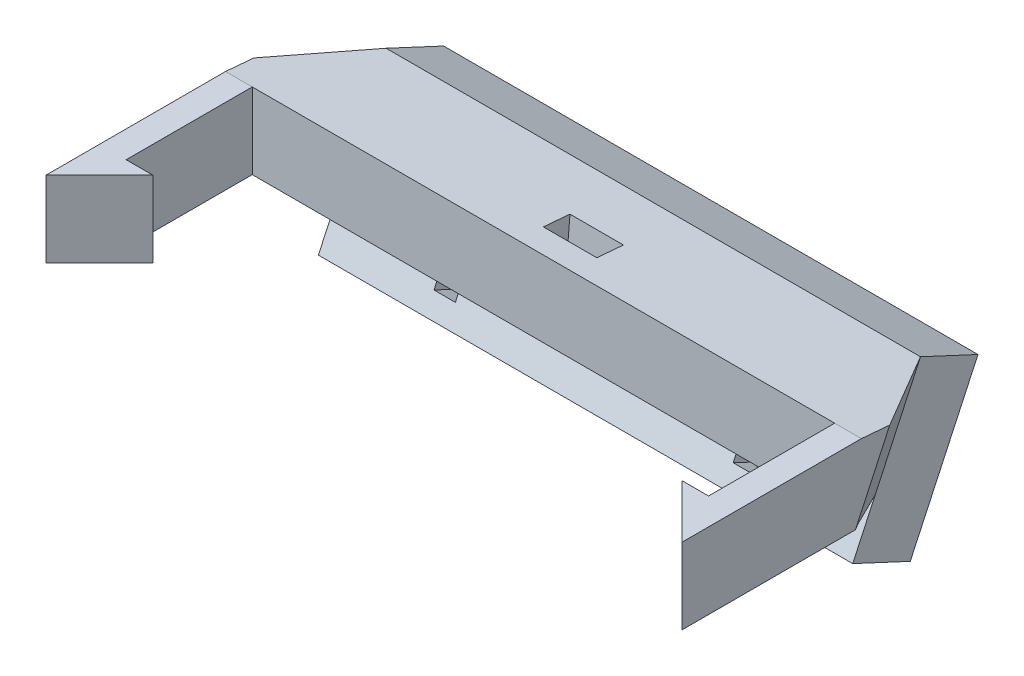
from build123d import *

# Parameters (mm, degrees)
SKETCH1_W                      = 75.565
SKETCH1_H                      = 35.56
BOSS_EXTRUDE1_DEPTH            = 3.175
SKETCH6_W                      = 3.175
SKETCH6_H                      = 9.028368652
BOSS_EXTRUDE4_DEPTH            = 14.986
BOSS_EXTRUDE6_DEPTH            = 9.028368652
BOSS_EXTRUDE7_DEPTH            = 75.565
SKETCH10_W                     = 75.565
SKETCH10_H                     = 23.368
BOSS_EXTRUDE8_DEPTH            = 7.545165067
CUT_EXTRUDE1_DEPTH             = 82.271037461
CUT_EXTRUDE2_REACH             = 52.467
SKETCH12_W                     = 6.35
SKETCH12_H                     = 3.175
CUT_EXTRUDE2_DIRECTION_2_DEPTH = 51.467280161
CUT_EXTRUDE3_DEPTH             = 54.64731815
CUT_EXTRUDE4_REACH             = 56.954
SKETCH14_W                     = 2.54
SKETCH14_H                     = 3.81
CUT_EXTRUDE5_REACH             = 56.954
SKETCH15_W                     = 114.661215645
SKETCH15_H                     = 5.616434986


with BuildPart() as part:
    # Sketch1 → Boss-Extrude1 (new body)
    with BuildSketch(Plane.XY):
        Rectangle(SKETCH1_W, SKETCH1_H)
    extrude(amount=-BOSS_EXTRUDE1_DEPTH)

    # Sketch6 → Boss-Extrude4 (add)
    with BuildSketch(Plane.XY):
        with Locations((-36.195, 0)):
            Rectangle(SKETCH6_W, SKETCH6_H)
        with Locations((36.195, 0)):
            Rectangle(SKETCH6_W, SKETCH6_H)
    extrude(amount=BOSS_EXTRUDE4_DEPTH)

    # Sketch8 → Boss-Extrude6 (add)
    with BuildSketch(Plane.XZ.offset(4.514184326)):
        Polygon((-37.7825, 14.986), (-31.4325, 14.986), (-37.7825, 21.336), align=None)
        Polygon((37.7825, 14.986), (31.4325, 14.986), (37.7825, 21.336), align=None)
    extrude(amount=-BOSS_EXTRUDE6_DEPTH)

    # Sketch9 → Boss-Extrude7 (add)
    with BuildSketch(Plane.ZY.offset(37.7825)):
        Polygon((-3.175, 17.78), (-16.795270199, 11.4287637), (-3.175, -17.78), align=None)
    extrude(amount=-BOSS_EXTRUDE7_DEPTH)

    # Sketch10 → Boss-Extrude8 (add)
    with BuildSketch(Plane(origin=(0, -4.391713703, -9.41806043), x_dir=(-1, 0, 0), z_dir=(0, -0.4226182617407007, -0.9063077870366493))):
        with Locations((0, -3.088339472)):
            Rectangle(SKETCH10_W, SKETCH10_H)
    extrude(amount=BOSS_EXTRUDE8_DEPTH)

    # Sketch11 → Cut-Extrude1 (cut, through all)
    with BuildSketch(Plane.ZY.offset(37.7825)):
        Polygon((-13.05074354, 3.398600367), (0, 4.514184326), (36.888684706, 18.275511072), (5.286071508, 25.150339228), (-30.3838484, 8.233222823), align=None)
        Polygon((-3.175, -17.78), (-7.689027521, -8.099636743), (0, -4.514184326), (40.158547499, -20.406390647), (15.599703883, -25.394905756), align=None)
    extrude(amount=-CUT_EXTRUDE1_DEPTH, mode=Mode.SUBTRACT)

    # Cut-Extrude2: up to this plane
    cut_extrude2_end = Plane(origin=(37.7825, -8.099636743, -7.689027521), z_dir=(0, 0.9063077870366495, -0.4226182617407008))
    # Sketch12 → Cut-Extrude2 (cut, up to the surface)
    with BuildSketch(Plane(origin=(0, 4.481438837, -0.38307559), x_dir=(1, 0, 0), z_dir=(0, 0.9963664433600627, -0.08516989225083536)), mode=Mode.PRIVATE) as cut_extrude2_sk1:
        with Locations((0, 4.378027407)):
            Rectangle(SKETCH12_W, SKETCH12_H)
    cut_extrude2_tool1 = split(extrude(cut_extrude2_sk1.sketch, amount=-CUT_EXTRUDE2_REACH, mode=Mode.PRIVATE), bisect_by=cut_extrude2_end, keep=Keep.BOTH, mode=Mode.PRIVATE)
    add(cut_extrude2_tool1.solids().sort_by_distance((0, 4.108563, -4.745195))[0], mode=Mode.SUBTRACT)

    # Sketch12 → Cut-Extrude2 direction 2 (cut)
    with BuildSketch(Plane(origin=(0, 4.481438837, -0.38307559), x_dir=(1, 0, 0), z_dir=(0, 0.9963664433600627, -0.08516989225083536))):
        with Locations((0, 4.378027407)):
            Rectangle(SKETCH12_W, SKETCH12_H)
    extrude(amount=CUT_EXTRUDE2_DIRECTION_2_DEPTH, mode=Mode.SUBTRACT)

    # Sketch13 → Cut-Extrude3 (cut, through all)
    with BuildSketch(Plane(origin=(0, 7.790314071, -3.632683111), x_dir=(1, 0, 0), z_dir=(0, 0.9063077870366494, -0.4226182617407008))):
        Polygon((-31.75, 10.391679918), (-37.7825, 1.267223267), (-37.7825, 11.639630657), (-37.7825, 17.936844984), (-31.75, 17.936844984), align=None)
        Polygon((37.7825, 1.267223267), (37.7825, 11.639630657), (37.7825, 17.936844984), (31.75, 17.936844984), (31.75, 10.391679918), align=None)
    extrude(amount=-CUT_EXTRUDE3_DEPTH, mode=Mode.SUBTRACT)

    # Sketch14 → Cut-Extrude4 (cut, up to next)
    with BuildSketch(Plane(origin=(0, -7.580438248, -16.256302284), x_dir=(-1, 0, 0), z_dir=(0, -0.4226182617407007, -0.9063077870366494)), mode=Mode.PRIVATE) as cut_extrude4_sk1:
        with Locations((-17.78, -6.082892111)):
            Rectangle(SKETCH14_W, SKETCH14_H)
    cut_extrude4_tool1 = extrude(cut_extrude4_sk1.sketch, amount=-CUT_EXTRUDE4_REACH, mode=Mode.PRIVATE) & part.part
    # Sketch14 → Cut-Extrude4 (cut, up to next)
    with BuildSketch(Plane(origin=(0, -7.580438248, -16.256302284), x_dir=(-1, 0, 0), z_dir=(0, -0.4226182617407007, -0.9063077870366494)), mode=Mode.PRIVATE) as cut_extrude4_sk2:
        with Locations((17.78, -6.082892111)):
            Rectangle(SKETCH14_W, SKETCH14_H)
    cut_extrude4_tool2 = extrude(cut_extrude4_sk2.sketch, amount=-CUT_EXTRUDE4_REACH, mode=Mode.PRIVATE) & part.part
    add(cut_extrude4_tool1.solids().sort_by_distance((17.78, -13.093411, -13.685561))[0], mode=Mode.SUBTRACT)
    add(cut_extrude4_tool2.solids().sort_by_distance((-17.78, -13.093411, -13.685561))[0], mode=Mode.SUBTRACT)

    # Sketch15 → Cut-Extrude5 (cut, up to next)
    with BuildSketch(Plane(origin=(0, -7.580438248, -16.256302284), x_dir=(-1, 0, 0), z_dir=(0, -0.42261826174070083, -0.9063077870366494)), mode=Mode.PRIVATE) as cut_extrude5_sk1:
        with Locations((-7.679066914, -13.262556965)):
            Rectangle(SKETCH15_W, SKETCH15_H)
    cut_extrude5_tool1 = extrude(cut_extrude5_sk1.sketch, amount=-CUT_EXTRUDE5_REACH, mode=Mode.PRIVATE) & part.part
    add(cut_extrude5_tool1.solids().sort_by_distance((7.679067, -19.600397, -10.651304))[0], mode=Mode.SUBTRACT)


solid = part.part
